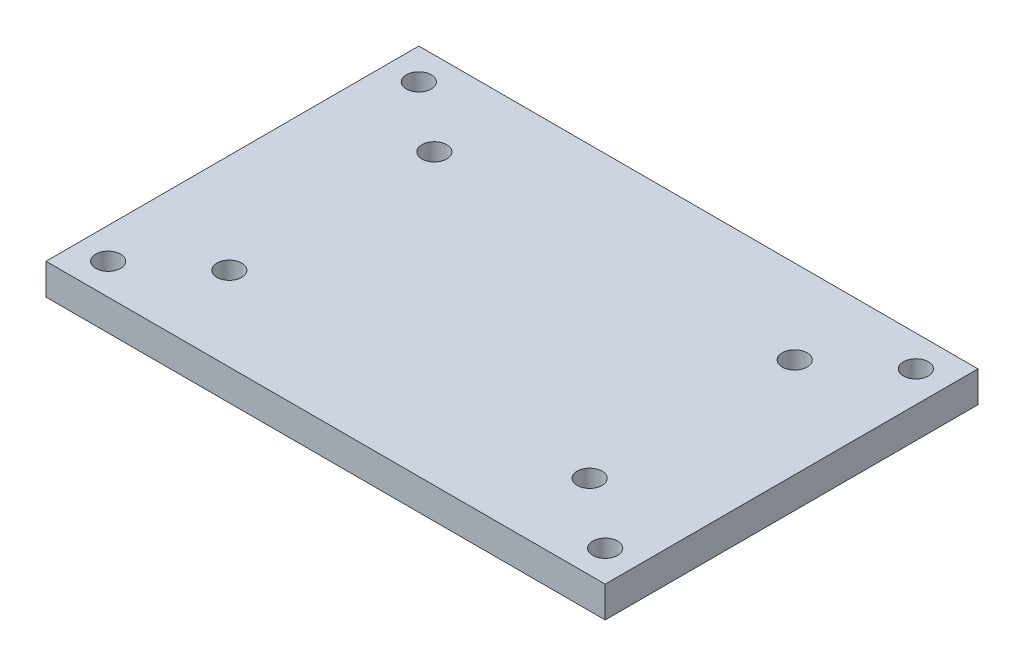
from build123d import *

# Parameters (mm, degrees)
SKETCH_1_W      = 90
SKETCH_1_H      = 60
SKETCH_1_R      = 2
EXTRUDE_1_DEPTH = 5


with BuildPart() as part:
    # 草图1 → 凸台-拉伸1 (new body)
    with BuildSketch(Plane(origin=(0, 0, 0), x_dir=(1, 0, 0), z_dir=(0, 1, 0))):
        Rectangle(SKETCH_1_W, SKETCH_1_H)
        with Locations(Location((-40, 25, 0), (0, 0, 270))):
            Circle(SKETCH_1_R, mode=Mode.SUBTRACT)
        with Locations(Location((40, 25, 0), (0, 0, 270))):
            Circle(SKETCH_1_R, mode=Mode.SUBTRACT)
        with Locations(Location((40, -25, 0), (0, 0, 90))):
            Circle(SKETCH_1_R, mode=Mode.SUBTRACT)
        with Locations(Location((-40, -25, 0), (0, 0, 90))):
            Circle(SKETCH_1_R, mode=Mode.SUBTRACT)
        with Locations(Location((-29, 16.5, 0), (0, 0, 270))):
            Circle(SKETCH_1_R, mode=Mode.SUBTRACT)
        with Locations(Location((29, 16.5, 0), (0, 0, 90))):
            Circle(SKETCH_1_R, mode=Mode.SUBTRACT)
        with Locations(Location((29, -16.5, 0), (0, 0, 270))):
            Circle(SKETCH_1_R, mode=Mode.SUBTRACT)
        with Locations(Location((-29, -16.5, 0), (0, 0, 90))):
            Circle(SKETCH_1_R, mode=Mode.SUBTRACT)
    extrude(amount=EXTRUDE_1_DEPTH)


solid = part.part
